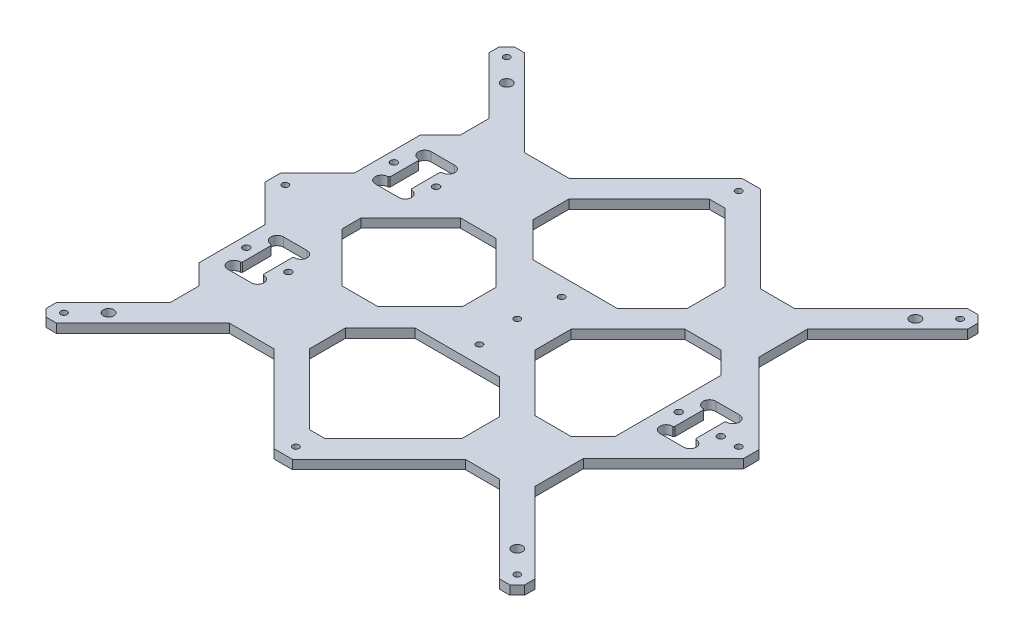
from build123d import *

# Parameters (mm, degrees)
SKETCH2_R            = 1.5
SKETCH2_R_2          = 1.6
BOSS_EXTRUDE2_DEPTH  = 4.25
SKETCH4_R            = 2.5
HOLES_TO_DRILL_DEPTH = 416.108494854


with BuildPart() as part:
    # Sketch2 → Boss-Extrude2 (new body)
    with BuildSketch(Plane(origin=(0, 0, 0), x_dir=(1, 0, 0), z_dir=(0, 1, 0))):
        Polygon((184.400116, 296), (225.400116, 255), (241.514718626, 255), (282.514718626, 296), (287.485169777, 296), (291, 292.485169777), (291, 287.514718626), (253, 249.514718626), (253, 226.666961), (291, 188.666961), (291, 181.333039), (253, 143.333039), (253, 120.485281374), (291, 82.485281374), (291, 77.514830223), (287.485169777, 74), (282.514718626, 74), (241.514718626, 115), (225.400116, 115), (184.400116, 74), (175.599884, 74), (134.599884, 115), (113.485281374, 115), (72.485281374, 74), (67.514830223, 74), (64, 77.514830223), (64, 82.485281374), (91, 109.485281374), (91, 123), (81.5, 132.5), (81.5, 163.760895), (64, 181.260895), (64, 188.739105), (81.5, 206.239105), (81.5, 237.5), (91, 247), (91, 260.514718626), (64, 287.514718626), (64, 292.485169777), (67.514830223, 296), (72.485281374, 296), (113.485281374, 255), (134.599884, 255), (175.599884, 296), align=None)
        with Locations(Location((180, 80, 0), (0, 0, 270))):
            Circle(SKETCH2_R, mode=Mode.SUBTRACT)
        with Locations(Location((180, 290, 0), (0, 0, 270))):
            Circle(SKETCH2_R, mode=Mode.SUBTRACT)
        with Locations(Location((285, 80, 0), (0, 0, 270))):
            Circle(SKETCH2_R, mode=Mode.SUBTRACT)
        with Locations(Location((70, 290, 0), (0, 0, 270))):
            Circle(SKETCH2_R, mode=Mode.SUBTRACT)
        with Locations(Location((285, 290, 0), (0, 0, 270))):
            Circle(SKETCH2_R, mode=Mode.SUBTRACT)
        with Locations(Location((70, 185, 0), (0, 0, 270))):
            Circle(SKETCH2_R, mode=Mode.SUBTRACT)
        with Locations(Location((180, 185, 0), (0, 0, 270))):
            Circle(SKETCH2_R, mode=Mode.SUBTRACT)
        with Locations(Location((285, 185, 0), (0, 0, 270))):
            Circle(SKETCH2_R, mode=Mode.SUBTRACT)
        with Locations(Location((256.5, 185, 0), (0, 0, 270))):
            Circle(SKETCH2_R_2, mode=Mode.SUBTRACT)
        with Locations(Location((276.5, 185, 0), (0, 0, 270))):
            Circle(SKETCH2_R_2, mode=Mode.SUBTRACT)
        with Locations(Location((106.5, 220, 0), (0, 0, 270))):
            Circle(SKETCH2_R_2, mode=Mode.SUBTRACT)
        with Locations(Location((106.5, 150, 0), (0, 0, 270))):
            Circle(SKETCH2_R_2, mode=Mode.SUBTRACT)
        with Locations(Location((86.5, 220, 0), (0, 0, 270))):
            Circle(SKETCH2_R_2, mode=Mode.SUBTRACT)
        with Locations(Location((86.5, 150, 0), (0, 0, 270))):
            Circle(SKETCH2_R_2, mode=Mode.SUBTRACT)
        with Locations(Location((70, 80, 0), (0, 0, 270))):
            Circle(SKETCH2_R, mode=Mode.SUBTRACT)
        with Locations(Location((181.5, 165.5, 0), (0, 0, 270))):
            Circle(SKETCH2_R, mode=Mode.SUBTRACT)
        with Locations(Location((181.5, 204.5, 0), (0, 0, 270))):
            Circle(SKETCH2_R, mode=Mode.SUBTRACT)
        Polygon((162, 177.02296782), (141.97703218, 157), (124.999970007, 157), (101.5, 180.5), (101.5, 189.5), (124.999970007, 213), (141.97703218, 213), (162, 192.97703218), align=None, mode=Mode.SUBTRACT)
        Polygon((251.5, 210.014709), (240.98529, 220.529449), (224.014709, 220.529449), (197, 193.51474), (197, 176.48526), (224.014709, 149.470551), (240.98529, 149.470551), (251.5, 159.985291), align=None, mode=Mode.SUBTRACT)
        Polygon((143, 246.415771), (143, 229.566314), (159.566314, 213), (199.51474, 213), (216, 229.48526), (216, 247.429580116), (183.682617, 279.746963116), (176.317383, 279.733154), align=None, mode=Mode.SUBTRACT)
        Polygon((143, 123.584229), (143, 140.433686), (159.566314, 157), (199.51474, 157), (216, 140.51474), (216, 122.570419884), (183.682617, 90.253036884), (176.317383, 90.266846), align=None, mode=Mode.SUBTRACT)
        with BuildLine():
            Line((101.500000013, 226.75), (101.500000013, 213.25))
            Line((101.500000013, 213.25), (102.000000013, 212.75))
            Line((102.000000013, 212.75), (102.100000157, 212.75))
            ThreePointArc((102.100000157, 212.75), (105.1, 209.75), (102.100000157, 206.75))
            Line((102.100000157, 206.75), (90.899999843, 206.75))
            ThreePointArc((90.899999843, 206.75), (87.9, 209.75), (90.899999843, 212.75))
            Line((90.899999843, 212.75), (90.999999987, 212.75))
            Line((90.999999987, 212.75), (91.499999987, 213.25))
            Line((91.499999987, 213.25), (91.499999987, 226.75))
            Line((91.499999987, 226.75), (90.999999987, 227.25))
            Line((90.999999987, 227.25), (90.899999843, 227.25))
            ThreePointArc((90.899999843, 227.25), (87.9, 230.25), (90.899999843, 233.25))
            Line((90.899999843, 233.25), (102.100000157, 233.25))
            ThreePointArc((102.100000157, 233.25), (105.100000157, 230.25), (102.100000157, 227.25))
            Line((102.100000157, 227.25), (102.000000013, 227.25))
            Line((102.000000013, 227.25), (101.500000013, 226.75))
        make_face(mode=Mode.SUBTRACT)
        with BuildLine():
            Line((271.500000013, 191.75), (271.500000013, 178.25))
            Line((271.500000013, 178.25), (272.000000013, 177.75))
            Line((272.000000013, 177.75), (272.100000157, 177.75))
            ThreePointArc((272.100000157, 177.75), (275.100000157, 174.75), (272.100000157, 171.75))
            Line((272.100000157, 171.75), (260.899999843, 171.75))
            ThreePointArc((260.899999843, 171.75), (257.9, 174.75), (260.899999843, 177.75))
            Line((260.899999843, 177.75), (260.999999987, 177.75))
            Line((260.999999987, 177.75), (261.499999987, 178.25))
            Line((261.499999987, 178.25), (261.499999987, 191.75))
            Line((261.499999987, 191.75), (260.999999987, 192.25))
            Line((260.999999987, 192.25), (260.899999843, 192.25))
            ThreePointArc((260.899999843, 192.25), (257.9, 195.25), (260.899999843, 198.25))
            Line((260.899999843, 198.25), (272.100000157, 198.25))
            ThreePointArc((272.100000157, 198.25), (275.100000157, 195.25), (272.100000157, 192.25))
            Line((272.100000157, 192.25), (272.000000013, 192.25))
            Line((272.000000013, 192.25), (271.500000013, 191.75))
        make_face(mode=Mode.SUBTRACT)
        with BuildLine():
            Line((101.500000013, 156.75), (101.500000013, 143.25))
            Line((101.500000013, 143.25), (102.000000013, 142.75))
            Line((102.000000013, 142.75), (102.100000157, 142.75))
            ThreePointArc((102.100000157, 142.75), (105.1, 139.75), (102.100000157, 136.75))
            Line((102.100000157, 136.75), (90.899999843, 136.75))
            ThreePointArc((90.899999843, 136.75), (87.9, 139.75), (90.899999843, 142.75))
            Line((90.899999843, 142.75), (90.999999987, 142.75))
            Line((90.999999987, 142.75), (91.499999987, 143.25))
            Line((91.499999987, 143.25), (91.499999987, 156.75))
            Line((91.499999987, 156.75), (90.999999987, 157.25))
            Line((90.999999987, 157.25), (90.899999843, 157.25))
            ThreePointArc((90.899999843, 157.25), (87.9, 160.25), (90.899999843, 163.25))
            Line((90.899999843, 163.25), (102.100000157, 163.25))
            ThreePointArc((102.100000157, 163.25), (105.100000157, 160.25), (102.100000157, 157.25))
            Line((102.100000157, 157.25), (102.000000013, 157.25))
            Line((102.000000013, 157.25), (101.500000013, 156.75))
        make_face(mode=Mode.SUBTRACT)
    extrude(amount=BOSS_EXTRUDE2_DEPTH)

    # Sketch4 → Holes-to-drill (cut, through all)
    with BuildSketch(Plane(origin=(0, 4.25, 0), x_dir=(1, 0, 0), z_dir=(0, 1, 0))):
        with Locations(Location((80.606601718, 279.393398282, 0), (0, 0, 270))):
            Circle(SKETCH4_R)
        with Locations(Location((274.393398282, 279.393398282, 0), (0, 0, 270))):
            Circle(SKETCH4_R)
        with Locations(Location((80.606601718, 90.606601718, 0), (0, 0, 270))):
            Circle(SKETCH4_R)
        with Locations(Location((274.393398282, 90.606601718, 0), (0, 0, 270))):
            Circle(SKETCH4_R)
    extrude(amount=-HOLES_TO_DRILL_DEPTH, mode=Mode.SUBTRACT)


solid = part.part
